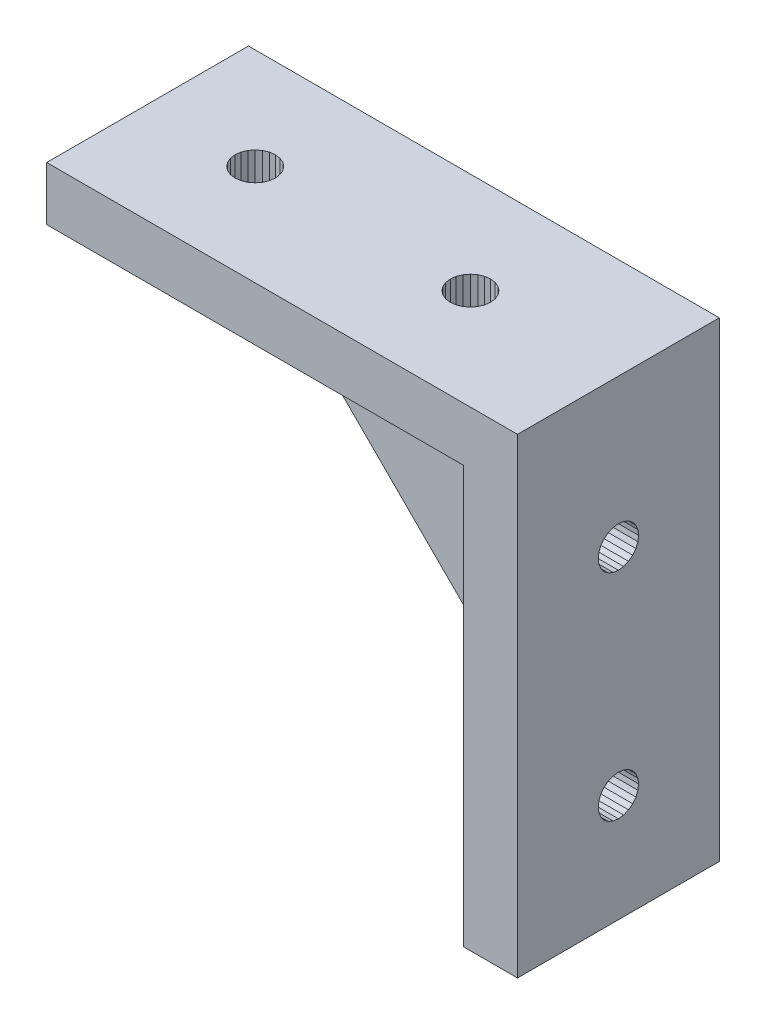
from build123d import *

# Parameters (mm, degrees)
SKETCH1_W           = 35
SKETCH1_H           = 31
BOSS_EXTRUDE1_DEPTH = 15
CUT_EXTRUDE1_DEPTH  = 4
SKETCH3_W           = 35
SKETCH3_H           = 15
BOSS_EXTRUDE2_DEPTH = 4
SKETCH4_W           = 11
SKETCH4_H           = 31
CUT_EXTRUDE2_DEPTH  = 31
CUT_EXTRUDE3_DEPTH  = 48.021271782
CUT_EXTRUDE4_DEPTH  = 54.018864567
CUT_EXTRUDE5_DEPTH  = 54.018864567
CUT_EXTRUDE6_DEPTH  = 50.749371855


with BuildPart() as part:
    # Sketch1 → Boss-Extrude1 (new body)
    with BuildSketch(Plane(origin=(0, 0, 10), x_dir=(-1, 0, 0), z_dir=(0, 0, -1))):
        with Locations((-7.5, -19.5)):
            Rectangle(SKETCH1_W, SKETCH1_H)
    extrude(amount=-BOSS_EXTRUDE1_DEPTH)

    # Sketch2 → Cut-Extrude1 (cut)
    with BuildSketch(Plane(origin=(0, 0, 10), x_dir=(-1, 0, 0), z_dir=(0, 0, -1))):
        Polygon((10, -4), (-21, -35), (10, -35), align=None)
    extrude(amount=-CUT_EXTRUDE1_DEPTH, mode=Mode.SUBTRACT)

    # Sketch3 → Boss-Extrude2 (add)
    with BuildSketch(Plane(origin=(0, -4, 0), x_dir=(-1, 0, 0), z_dir=(0, 1, 0))):
        with Locations((-7.5, 17.5)):
            Rectangle(SKETCH3_W, SKETCH3_H)
    extrude(amount=BOSS_EXTRUDE2_DEPTH)

    # Sketch4 → Cut-Extrude2 (cut)
    with BuildSketch(Plane.ZY.offset(10)):
        with Locations((19.5, -19.5)):
            Rectangle(SKETCH4_W, SKETCH4_H)
    extrude(amount=-CUT_EXTRUDE2_DEPTH, mode=Mode.SUBTRACT)

    # Sketch5 → Cut-Extrude3 (cut, through all)
    with BuildSketch(Plane.XZ.offset(4)):
        Polygon((-2.75, 16.20096), (-2.388229, 16.05111), (-2, 16), (-1.611771, 16.05111), (-1.25, 16.20096), (-0.9393398, 16.43934), (-0.7009619, 16.75), (-0.5511113, 17.11177), (-0.5, 17.5), (-0.5511113, 17.88823), (-0.7009619, 18.25), (-0.9393398, 18.56066), (-1.25, 18.79904), (-1.611771, 18.94889), (-2, 19), (-2.388229, 18.94889), (-2.75, 18.79904), (-3.06066, 18.56066), (-3.299038, 18.25), (-3.448889, 17.88823), (-3.5, 17.5), (-3.448889, 17.11177), (-3.299038, 16.75), (-3.06066, 16.43934), align=None)
    extrude(amount=-CUT_EXTRUDE3_DEPTH, mode=Mode.SUBTRACT)

    # Sketch6 → Cut-Extrude4 (cut, through all)
    with BuildSketch(Plane.ZY.offset(-21)):
        Polygon((17.11177, -28.44889), (17.5, -28.5), (17.88823, -28.44889), (18.25, -28.29904), (18.56066, -28.06066), (18.79904, -27.75), (18.94889, -27.38823), (19, -27), (18.94889, -26.61177), (18.79904, -26.25), (18.56066, -25.93934), (18.25, -25.70096), (17.88823, -25.55111), (17.5, -25.5), (17.11177, -25.55111), (16.75, -25.70096), (16.43934, -25.93934), (16.20096, -26.25), (16.05111, -26.61177), (16, -27), (16.05111, -27.38823), (16.20096, -27.75), (16.43934, -28.06066), (16.75, -28.29904), align=None)
    extrude(amount=-CUT_EXTRUDE4_DEPTH, mode=Mode.SUBTRACT)

    # Sketch7 → Cut-Extrude5 (cut, through all)
    with BuildSketch(Plane.ZY.offset(-21)):
        Polygon((16.20096, -11.75), (16.43934, -12.06066), (16.75, -12.29904), (17.11177, -12.44889), (17.5, -12.5), (17.88823, -12.44889), (18.25, -12.29904), (18.56066, -12.06066), (18.79904, -11.75), (18.94889, -11.38823), (19, -11), (18.94889, -10.61177), (18.79904, -10.25), (18.56066, -9.93934), (18.25, -9.700962), (17.88823, -9.551111), (17.5, -9.5), (17.11177, -9.551111), (16.75, -9.700962), (16.43934, -9.93934), (16.20096, -10.25), (16.05111, -10.61177), (16, -11), (16.05111, -11.38823), align=None)
    extrude(amount=-CUT_EXTRUDE5_DEPTH, mode=Mode.SUBTRACT)

    # Sketch8 → Cut-Extrude6 (cut, through all)
    with BuildSketch(Plane(origin=(0, 0, 0), x_dir=(-1, 0, 0), z_dir=(0, 1, 0))):
        Polygon((-12.70096, 16.75), (-12.55111, 17.11177), (-12.5, 17.5), (-12.55111, 17.88823), (-12.70096, 18.25), (-12.93934, 18.56066), (-13.25, 18.79904), (-13.61177, 18.94889), (-14, 19), (-14.38823, 18.94889), (-14.75, 18.79904), (-15.06066, 18.56066), (-15.29904, 18.25), (-15.44889, 17.88823), (-15.5, 17.5), (-15.44889, 17.11177), (-15.29904, 16.75), (-15.06066, 16.43934), (-14.75, 16.20096), (-14.38823, 16.05111), (-14, 16), (-13.61177, 16.05111), (-13.25, 16.20096), (-12.93934, 16.43934), align=None)
    extrude(amount=-CUT_EXTRUDE6_DEPTH, mode=Mode.SUBTRACT)


solid = part.part
